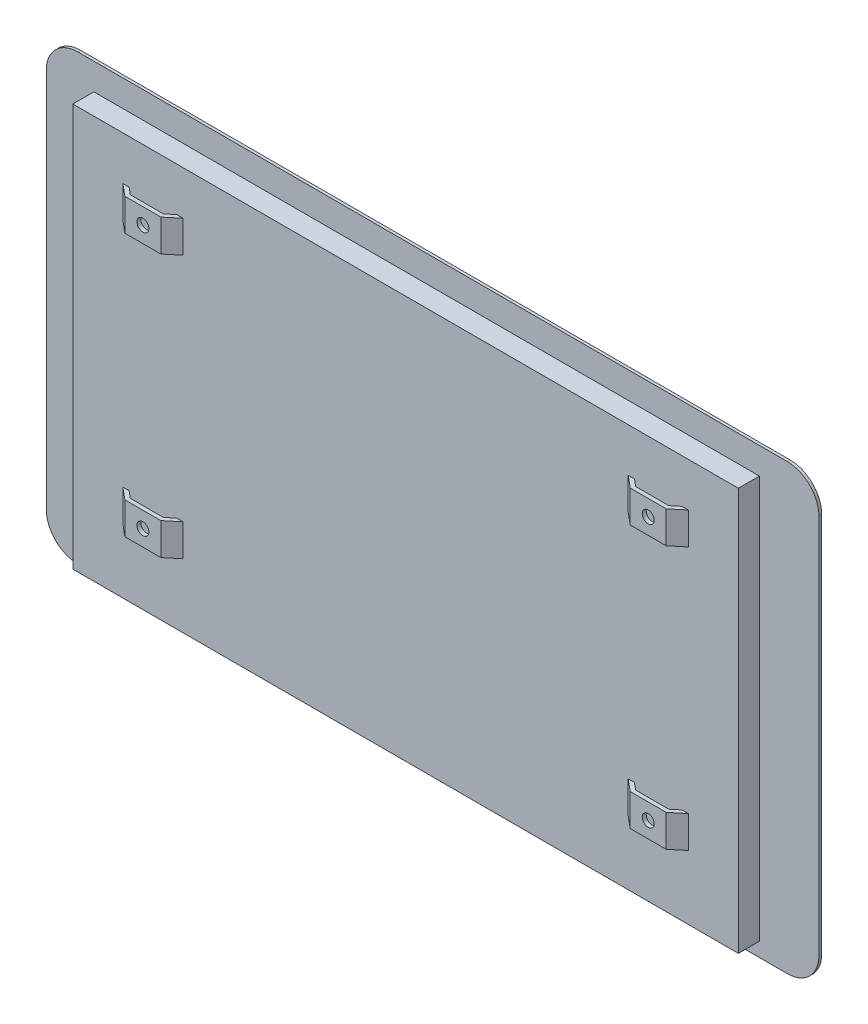
from build123d import *

# Parameters (mm, degrees)
BOSS_EXTRUDE1_DEPTH     = 0.7
SKETCH2_W               = 166.2
SKETCH2_H               = 100.6
BOSS_EXTRUDE2_DEPTH     = 5.26
SKETCH3_W               = 15
SKETCH3_H               = 8
BOSS_EXTRUDE3_DEPTH     = 2.5
CUT_EXTRUDE1_DEPTH      = 134.052151054
CUT_EXTRUDE1_DEPTH_BACK = 134.052151054
CUT_EXTRUDE2_REACH      = 113.566
SKETCH5_R               = 1.5


with BuildPart() as part:
    # Sketch1 → Boss-Extrude1 (new body)
    with BuildSketch(Plane.XY):
        with BuildLine():
            Line((-88.6, 55.38), (88.6, 55.38))
            ThreePointArc((88.6, 55.38), (94.172001436, 53.072001436), (96.48, 47.5))
            Line((96.48, 47.5), (96.48, -47.5))
            ThreePointArc((96.48, -47.5), (94.172001436, -53.072001436), (88.6, -55.38))
            Line((88.6, -55.38), (-88.6, -55.38))
            ThreePointArc((-88.6, -55.38), (-94.172001436, -53.072001436), (-96.48, -47.5))
            Line((-96.48, -47.5), (-96.48, 47.5))
            ThreePointArc((-96.48, 47.5), (-94.172001436, 53.072001436), (-88.6, 55.38))
        make_face()
    extrude(amount=BOSS_EXTRUDE1_DEPTH)

    # Sketch2 → Boss-Extrude2 (add)
    with BuildSketch(Plane.XY.offset(0.7)):
        with Locations((-1.49, -1.55)):
            Rectangle(SKETCH2_W, SKETCH2_H)
    extrude(amount=BOSS_EXTRUDE2_DEPTH)

    # Sketch3 → Boss-Extrude3 (add)
    with BuildSketch(Plane.XY.offset(5.96)):
        with Locations((-64.59, 33.8)):
            Rectangle(SKETCH3_W, SKETCH3_H)
        with Locations((-64.59, -31.85)):
            Rectangle(SKETCH3_W, SKETCH3_H)
        with Locations((61.61, 33.8)):
            Rectangle(SKETCH3_W, SKETCH3_H)
        with Locations((61.61, -31.85)):
            Rectangle(SKETCH3_W, SKETCH3_H)
    extrude(amount=BOSS_EXTRUDE3_DEPTH)

    # Sketch4 → Cut-Extrude1 (cut, two sides: drawn at the far end of the back side and taken through both)
    with BuildSketch(Plane.XZ.offset(35.85).offset(-CUT_EXTRUDE1_DEPTH_BACK)):
        Polygon((-72.09, 8.46), (-72.09, 5.96), (-69.09, 8.46), align=None)
        Polygon((-57.09, 5.96), (-57.09, 8.46), (-60.09, 8.46), align=None)
        Polygon((-60.452049935, 7.46), (-68.727950065, 7.46), (-70.527950065, 5.96), (-58.652049935, 5.96), align=None)
        Polygon((55.672049935, 5.96), (57.472049935, 7.46), (65.747950065, 7.46), (67.547950065, 5.96), align=None)
        Polygon((57.11, 8.46), (54.11, 5.96), (54.11, 8.46), align=None)
        Polygon((66.11, 8.46), (69.11, 8.46), (69.11, 5.96), align=None)
    extrude(amount=CUT_EXTRUDE1_DEPTH + CUT_EXTRUDE1_DEPTH_BACK, mode=Mode.SUBTRACT)

    # Sketch5 → Cut-Extrude2 (cut, up to next)
    with BuildSketch(Plane.XY.offset(8.46), mode=Mode.PRIVATE) as cut_extrude2_sk1:
        with Locations((-64.59, 33.8)):
            Circle(SKETCH5_R)
    cut_extrude2_tool1 = extrude(cut_extrude2_sk1.sketch, amount=-CUT_EXTRUDE2_REACH, mode=Mode.PRIVATE) & part.part
    # Sketch5 → Cut-Extrude2 (cut, up to next)
    with BuildSketch(Plane.XY.offset(8.46), mode=Mode.PRIVATE) as cut_extrude2_sk2:
        with Locations((-64.59, -31.85)):
            Circle(SKETCH5_R)
    cut_extrude2_tool2 = extrude(cut_extrude2_sk2.sketch, amount=-CUT_EXTRUDE2_REACH, mode=Mode.PRIVATE) & part.part
    # Sketch5 → Cut-Extrude2 (cut, up to next)
    with BuildSketch(Plane.XY.offset(8.46), mode=Mode.PRIVATE) as cut_extrude2_sk3:
        with Locations((61.61, -31.85)):
            Circle(SKETCH5_R)
    cut_extrude2_tool3 = extrude(cut_extrude2_sk3.sketch, amount=-CUT_EXTRUDE2_REACH, mode=Mode.PRIVATE) & part.part
    # Sketch5 → Cut-Extrude2 (cut, up to next)
    with BuildSketch(Plane.XY.offset(8.46), mode=Mode.PRIVATE) as cut_extrude2_sk4:
        with Locations((61.61, 33.8)):
            Circle(SKETCH5_R)
    cut_extrude2_tool4 = extrude(cut_extrude2_sk4.sketch, amount=-CUT_EXTRUDE2_REACH, mode=Mode.PRIVATE) & part.part
    add(cut_extrude2_tool1.solids().sort_by_distance((-64.59, 33.8, 8.46))[0], mode=Mode.SUBTRACT)
    add(cut_extrude2_tool2.solids().sort_by_distance((-64.59, -31.85, 8.46))[0], mode=Mode.SUBTRACT)
    add(cut_extrude2_tool3.solids().sort_by_distance((61.61, -31.85, 8.46))[0], mode=Mode.SUBTRACT)
    add(cut_extrude2_tool4.solids().sort_by_distance((61.61, 33.8, 8.46))[0], mode=Mode.SUBTRACT)


solid = part.part
